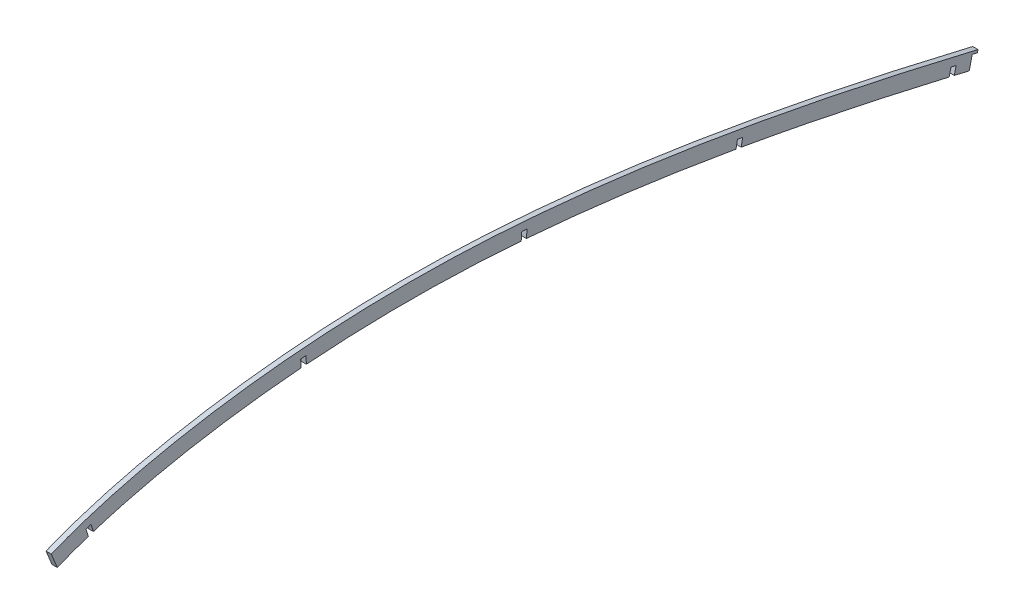
from build123d import *

# Parameters (mm, degrees)
BOSS_EXTRUDE2_START = 1.5875
BOSS_EXTRUDE2_DEPTH = 3.175


with BuildPart() as part:
    # Sketch1 → Boss-Extrude2 (new body)
    with BuildSketch(Plane(origin=(0, 0, 0), x_dir=(0, 0, -1), z_dir=(1, 0, 0)).offset(BOSS_EXTRUDE2_START)):
        with BuildLine():
            add(Edge.make_bspline(
                [(617.296334759, 26.403582169), (615.184301915, 26.908512482), (610.959288876, 27.914287333), (590.127541527, 32.829631776), (554.428003339, 40.913855014), (503.686138006, 51.318593932), (452.392596731, 60.465829991), (400.843471229, 67.985015872), (357.679132335, 72.589063507), (323.056220782, 75.05029926), (288.383000879, 76.508441281), (253.666561863, 76.425834439), (219.00998711, 74.703065258), (193.082327137, 72.512170168), (167.246128756, 69.410412561), (141.548940999, 65.354237292), (116.056003419, 60.208718519), (95.065092929, 54.851033869), (78.512288233, 49.775279208), (68.676082386, 46.349486029), (61.98632054, 43.782524426), (59.349501123, 42.721922328), (58.35028136, 42.31261335)],
                knots=[0.235495017, 0.235495017, 0.235495017, 0.235495017, 0.243307517, 0.251120017, 0.3125, 0.375, 0.4375, 0.5, 0.5625, 0.59375, 0.625, 0.6875, 0.71875, 0.75, 0.78125, 0.8125, 0.84375, 0.875, 0.890625, 0.90625, 0.912623667, 0.916529917, 0.916529917, 0.916529917, 0.916529917], degree=3))
            Line((58.35028136, 42.31261335), (61.960818582, 33.498440334))
            add(Edge.make_bspline(
                [(80.765487592, 40.403971738), (80.641658459, 40.363120288), (79.705797378, 40.053764879), (76.058349534, 38.829801361), (69.87113551, 36.632249503), (64.588433246, 34.574786411), (61.960818582, 33.498440334)],
                knots=[0.891585006, 0.891585006, 0.891585006, 0.891585006, 0.892069486, 0.895247576, 0.905888747, 0.916529917, 0.916529917, 0.916529917, 0.916529917], degree=3))
            Line((80.765487592, 40.403971738), (79.272271862, 44.930215281))
            Line((79.272271862, 44.930215281), (82.292039539, 45.9108417))
            Line((82.292039539, 45.9108417), (83.743360553, 41.371042866))
            add(Edge.make_bspline(
                [(209.118614924, 64.266949703), (208.987607746, 64.256277984), (204.983606318, 63.929041788), (189.3689148, 62.525717248), (162.355837105, 59.226646099), (133.710472047, 54.218983274), (111.101045047, 49.13527315), (96.457540116, 45.269363387), (87.39676216, 42.536792097), (83.867679496, 41.41078619), (83.743360553, 41.371042866)],
                knots=[0.731607855, 0.731607855, 0.731607855, 0.731607855, 0.732087614, 0.746271192, 0.788835873, 0.831400555, 0.852682895, 0.873965236, 0.887225543, 0.887709851, 0.887709851, 0.887709851, 0.887709851], degree=3))
            Line((209.118614924, 64.266949703), (208.73180914, 69.015419412))
            Line((208.73180914, 69.015419412), (211.896871614, 69.266426461))
            Line((211.896871614, 69.266426461), (212.263363621, 64.516346849))
            add(Edge.make_bspline(
                [(341.77301052, 64.125891337), (341.641715735, 64.135975948), (340.086535396, 64.255117907), (326.855067365, 65.235313291), (302.0845014, 66.573100845), (267.019938729, 67.029511391), (237.191430938, 66.186839541), (218.967979086, 65.031872482), (212.394418494, 64.526458377), (212.263363621, 64.516346849)],
                knots=[0.570343597, 0.570343597, 0.570343597, 0.570343597, 0.570822185, 0.576012467, 0.618577148, 0.661141829, 0.703706511, 0.727290053, 0.727769806, 0.727769806, 0.727769806, 0.727769806], degree=3))
            Line((341.77301052, 64.125891337), (342.137830582, 68.87560072))
            Line((342.137830582, 68.87560072), (345.303134285, 68.627654217))
            Line((345.303134285, 68.627654217), (344.924025936, 63.879074739))
            add(Edge.make_bspline(
                [(471.36269634, 47.333243498), (471.232728453, 47.355942137), (449.859334549, 51.086308134), (416.816830974, 56.23284789), (374.87201984, 61.216445173), (354.12724004, 63.142633245), (345.055315661, 63.868593071), (344.924025936, 63.879074739)],
                knots=[0.412374275, 0.412374275, 0.412374275, 0.412374275, 0.41285168, 0.490883104, 0.533447786, 0.566036483, 0.566515036, 0.566515036, 0.566515036, 0.566515036], degree=3))
            Line((471.36269634, 47.333243498), (472.182177193, 52.025427747))
            Line((472.182177193, 52.025427747), (475.309347299, 51.476399398))
            Line((475.309347299, 51.476399398), (474.481525493, 46.785682475))
            add(Edge.make_bspline(
                [(599.908904815, 20.729034105), (599.780288878, 20.759131966), (581.87021839, 24.949139998), (540.91919667, 34.150667692), (499.303273759, 42.385681838), (475.373897939, 46.628107797), (474.611460048, 46.762751511), (474.481525493, 46.785682475)],
                knots=[0.25424764, 0.25424764, 0.25424764, 0.25424764, 0.254724311, 0.320624379, 0.405753742, 0.408077679, 0.408555073, 0.408555073, 0.408555073, 0.408555073], degree=3))
            Line((599.908904815, 20.729034105), (600.994167359, 25.366641285))
            Line((600.994167359, 25.366641285), (604.085283853, 24.641642099))
            Line((604.085283853, 24.641642099), (602.995386693, 20.005124146))
            add(Edge.make_bspline(
                [(611.993248957, 17.876436525), (611.735864961, 17.937711546), (610.172224401, 18.309767327), (607.301737758, 18.990564407), (604.559549516, 19.637345533), (603.12397738, 19.974896587), (602.995386693, 20.005124146)],
                knots=[0.239313408, 0.239313408, 0.239313408, 0.239313408, 0.240268006, 0.245112823, 0.24995764, 0.250434304, 0.250434304, 0.250434304, 0.250434304], degree=3))
            Line((611.993248957, 17.876436525), (613.839230468, 25.597845751))
            Line((613.839230468, 25.597845751), (616.927208468, 24.859593169))
            Line((616.927208468, 24.859593169), (617.296334759, 26.403582169))
        make_face()
    extrude(amount=BOSS_EXTRUDE2_DEPTH)


solid = part.part
